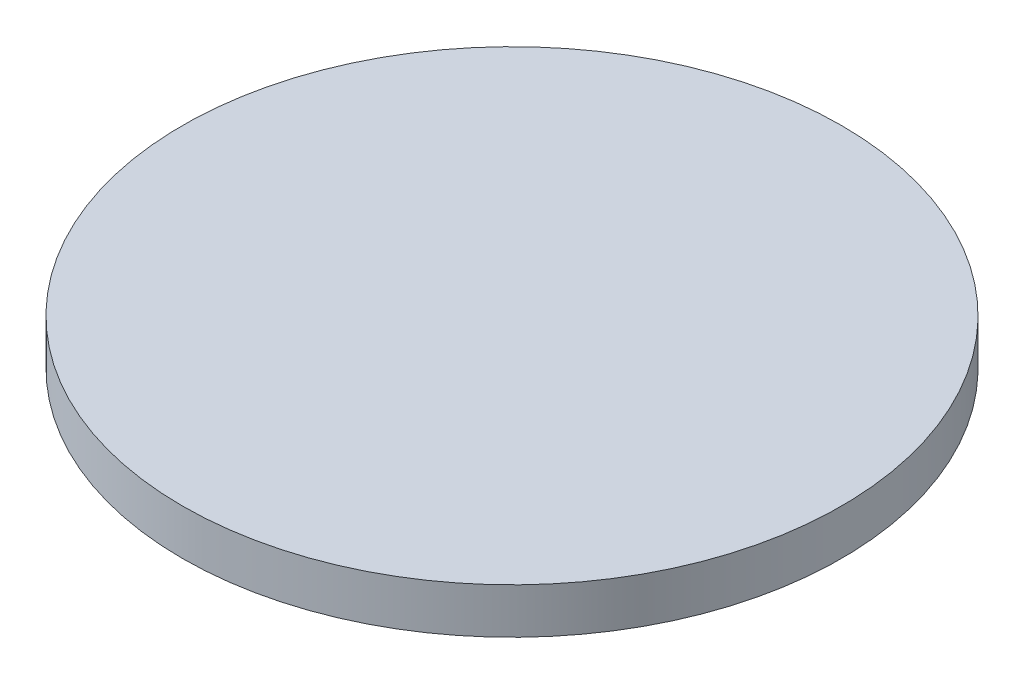
from build123d import *

# Parameters (mm, degrees)
SKETCH1_R           = 217.5
BOSS_EXTRUDE1_DEPTH = 15


with BuildPart() as part:
    # Sketch1 → Boss-Extrude1 (new, symmetric)
    with BuildSketch(Plane(origin=(0, 0, 0), x_dir=(1, 0, 0), z_dir=(0, 1, 0))):
        with Locations(Location((0, 0, 0), (0, 0, 270))):
            Circle(SKETCH1_R)
    extrude(amount=BOSS_EXTRUDE1_DEPTH, both=True)


solid = part.part
